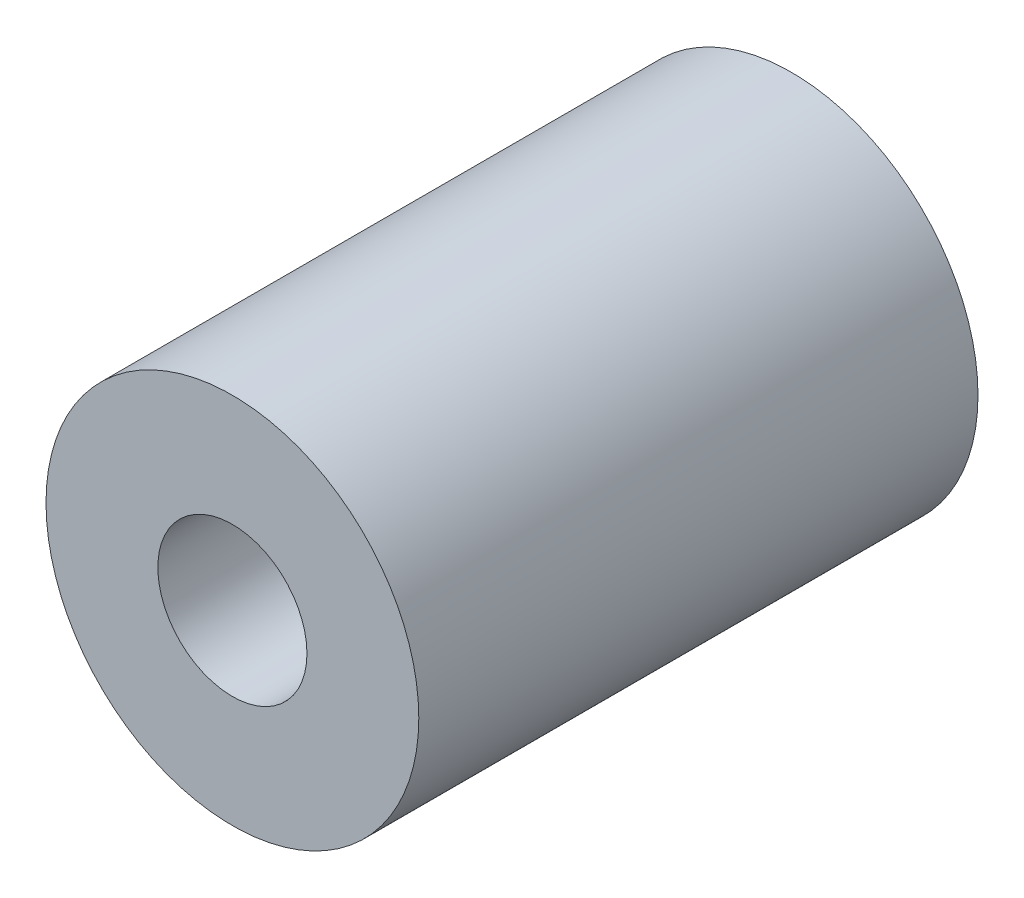
from build123d import *

# Parameters (mm, degrees)
SKETCH1_R           = 10
BOSS_EXTRUDE1_DEPTH = 30
SKETCH2_R           = 4
CUT_EXTRUDE1_DEPTH  = 30


with BuildPart() as part:
    # Sketch1 → Boss-Extrude1 (new body)
    with BuildSketch(Plane.XY):
        Circle(SKETCH1_R)
    extrude(amount=BOSS_EXTRUDE1_DEPTH)

    # Sketch2 → Cut-Extrude1 (cut)
    with BuildSketch(Plane.XY.offset(30)):
        Circle(SKETCH2_R)
    extrude(amount=-CUT_EXTRUDE1_DEPTH, mode=Mode.SUBTRACT)


solid = part.part
